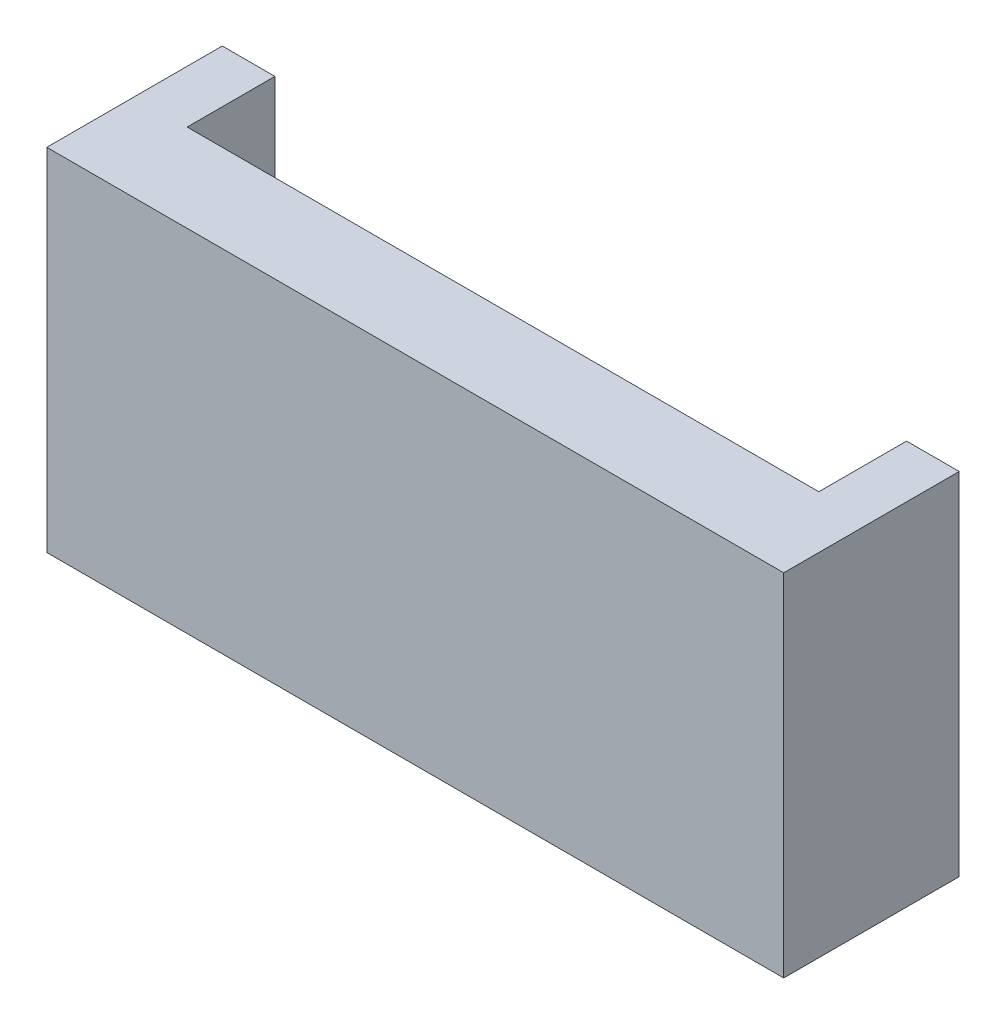
from build123d import *

# Parameters (mm, degrees)
SKETCH1_W           = 18
SKETCH1_H           = 5
BOSS_EXTRUDE1_DEPTH = 1.5
SKETCH2_W           = 18
SKETCH2_H           = 2.5
SKETCH2_W_2         = 4.8
SKETCH2_H_2         = 1
BOSS_EXTRUDE3_DEPTH = 4
SKETCH4_W           = 18
SKETCH4_H           = 2.5
BOSS_EXTRUDE4_DEPTH = 4.5
SKETCH6_W           = 5
SKETCH6_H           = 10
BOSS_EXTRUDE5_DEPTH = 1.5
SKETCH7_W           = 5
SKETCH7_H           = 10
BOSS_EXTRUDE6_DEPTH = 1.5


with BuildPart() as part:
    # Sketch1 → Boss-Extrude1 (new body)
    with BuildSketch(Plane(origin=(0, 0, 0), x_dir=(1, 0, 0), z_dir=(0, 1, 0))):
        with Locations((3.151785714, 0.111607143)):
            Rectangle(SKETCH1_W, SKETCH1_H)
    extrude(amount=BOSS_EXTRUDE1_DEPTH)

    # Sketch2 → Boss-Extrude3 (add)
    with BuildSketch(Plane(origin=(0, 1.5, 0), x_dir=(1, 0, 0), z_dir=(0, 1, 0))):
        with Locations((3.151785714, -1.138392857)):
            Rectangle(SKETCH2_W, SKETCH2_H)
        with Locations((-3.448214286, 2.111607143)):
            Rectangle(SKETCH2_W_2, SKETCH2_H_2)
        with Locations((9.751785714, 2.111607143)):
            Rectangle(SKETCH2_W_2, SKETCH2_H_2)
    extrude(amount=BOSS_EXTRUDE3_DEPTH)

    # Sketch4 → Boss-Extrude4 (add)
    with BuildSketch(Plane(origin=(0, 5.5, 0), x_dir=(1, 0, 0), z_dir=(0, 1, 0))):
        with Locations((3.151785714, -1.138392857)):
            Rectangle(SKETCH4_W, SKETCH4_H)
    extrude(amount=BOSS_EXTRUDE4_DEPTH)

    # Sketch6 → Boss-Extrude5 (add)
    with BuildSketch(Plane(origin=(12.151785714, 0, 0), x_dir=(0, 0, -1), z_dir=(1, 0, 0))):
        with Locations((0.111607143, 5)):
            Rectangle(SKETCH6_W, SKETCH6_H)
    extrude(amount=BOSS_EXTRUDE5_DEPTH)

    # Sketch7 → Boss-Extrude6 (add)
    with BuildSketch(Plane.ZY.offset(5.848214286)):
        with Locations((-0.111607143, 5)):
            Rectangle(SKETCH7_W, SKETCH7_H)
    extrude(amount=BOSS_EXTRUDE6_DEPTH)


solid = part.part
